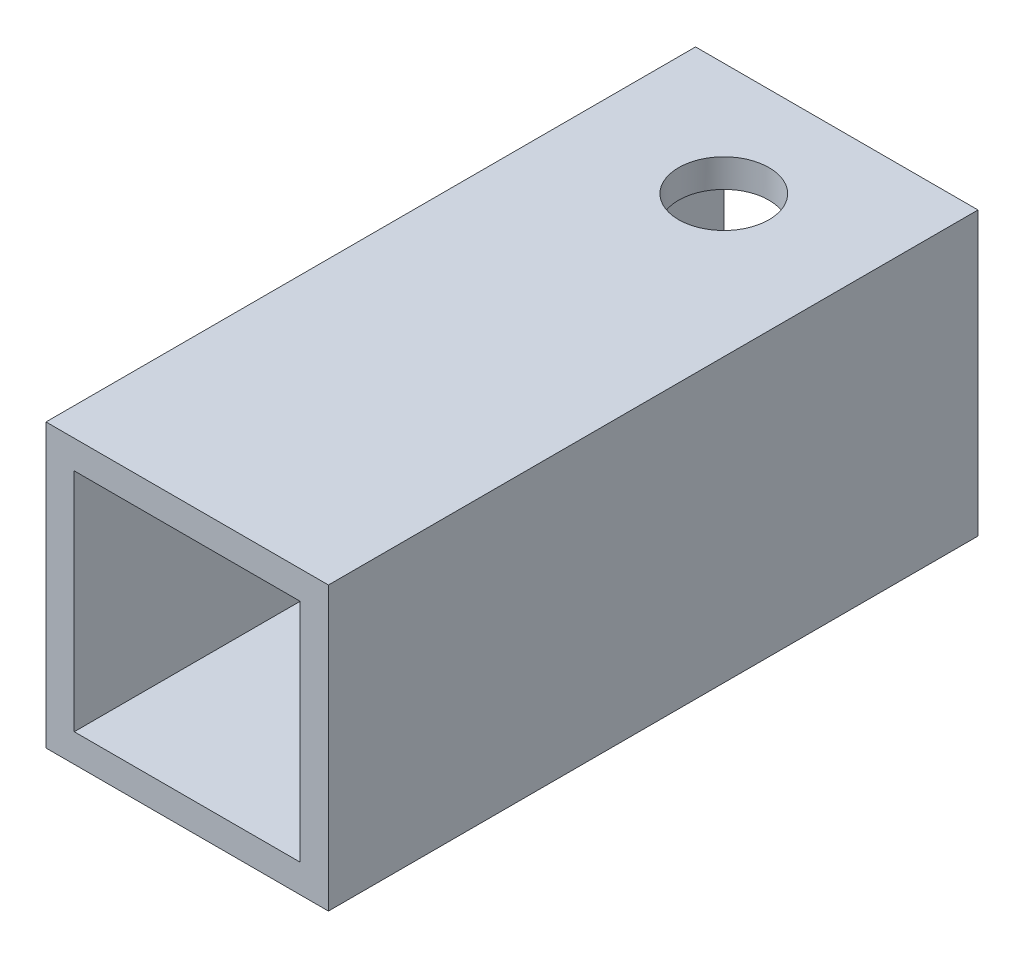
from build123d import *

# Parameters (mm, degrees)
SKETCH_281_W          = 10
SKETCH_281_H          = 10
SKETCH_281_W_2        = 8
SKETCH_281_H_2        = 8
EXTRUDE_338_DEPTH     = 23
SKETCH_410_R          = 1.6
CUT_EXTRUDE_739_DEPTH = 26.573423705


with BuildPart() as part:
    # Sketch 281 → Extrude 338 (new body)
    with BuildSketch(Plane.XY):
        Rectangle(SKETCH_281_W, SKETCH_281_H)
        Rectangle(SKETCH_281_W_2, SKETCH_281_H_2, mode=Mode.SUBTRACT)
    extrude(amount=EXTRUDE_338_DEPTH)

    # Sketch 410 → Cut-Extrude 739 (cut, through all)
    with BuildSketch(Plane(origin=(0, 5, 0), x_dir=(1, 0, 0), z_dir=(0, 1, 0))):
        with Locations(Location((0, -4, 0), (0, 0, 270))):
            Circle(SKETCH_410_R)
    extrude(amount=-CUT_EXTRUDE_739_DEPTH, mode=Mode.SUBTRACT)


solid = part.part
